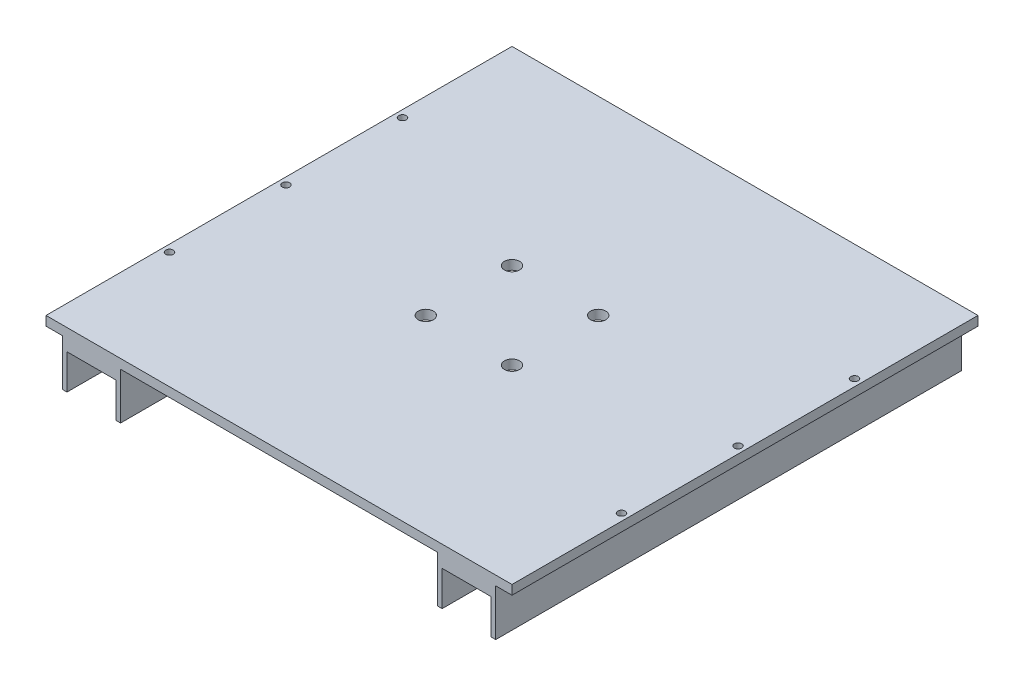
from build123d import *

# Parameters (mm, degrees)
SKETCH_1_W          = 200
SKETCH_1_H          = 200
EXTRUDE_1_DEPTH     = 4
SKETCH_2_W          = 2
SKETCH_2_H          = 200
EXTRUDE_2_DEPTH     = 20
SKETCH_4_R          = 3.25
SKETCH_4_R_2        = 1.6
CUT_EXTRUDE_1_DEPTH = 10
SKETCH_5_W          = 21
SKETCH_5_H          = 25
EXTRUDE_3_DEPTH     = 5


with BuildPart() as part:
    # 草图1 → 凸台-拉伸1 (new body)
    with BuildSketch(Plane(origin=(0, 0, 0), x_dir=(1, 0, 0), z_dir=(0, 1, 0))):
        Rectangle(SKETCH_1_W, SKETCH_1_H)
    extrude(amount=EXTRUDE_1_DEPTH)

    # 草图2 → 凸台-拉伸2 (add)
    with BuildSketch(Plane.XZ):
        with Locations((-69, 0)):
            Rectangle(SKETCH_2_W, SKETCH_2_H)
        with Locations((-92, 0)):
            Rectangle(SKETCH_2_W, SKETCH_2_H)
    extrude_2 = extrude(amount=EXTRUDE_2_DEPTH)

    # 镜向1: 凸台-拉伸2 across plane
    add(extrude_2.mirror(Plane(origin=(0, 0, 0), x_dir=(0, 0, 1), z_dir=(1, 0, 0))))

    # 草图4 → 切除-拉伸1 (cut)
    with BuildSketch(Plane(origin=(0, 4, 0), x_dir=(1, 0, 0), z_dir=(0, 1, 0))):
        with Locations(Location((18.5, 18.5, 0), (0, 0, 270))):
            Circle(SKETCH_4_R)
        with Locations(Location((18.5, -18.5, 0), (0, 0, 270))):
            Circle(SKETCH_4_R)
        with Locations(Location((-18.5, -18.5, 0), (0, 0, 270))):
            Circle(SKETCH_4_R)
        with Locations(Location((-18.5, 18.5, 0), (0, 0, 270))):
            Circle(SKETCH_4_R)
        with Locations(Location((97, -50, 0), (0, 0, 270))):
            Circle(SKETCH_4_R_2)
        with Locations(Location((97, 50, 0), (0, 0, 270))):
            Circle(SKETCH_4_R_2)
        with Locations(Location((-97, -50, 0), (0, 0, 270))):
            Circle(SKETCH_4_R_2)
        with Locations(Location((-97, 50, 0), (0, 0, 270))):
            Circle(SKETCH_4_R_2)
        with Locations(Location((-97, 0, 0), (0, 0, 270))):
            Circle(SKETCH_4_R_2)
        with Locations(Location((97, 0, 0), (0, 0, 270))):
            Circle(SKETCH_4_R_2)
    extrude(amount=-CUT_EXTRUDE_1_DEPTH, mode=Mode.SUBTRACT)

    # 草图5 → 凸台-拉伸3 (add)
    with BuildSketch(Plane.XZ):
        with Locations((80.5, 87.5)):
            Rectangle(SKETCH_5_W, SKETCH_5_H)
        with Locations((80.5, -87.5)):
            Rectangle(SKETCH_5_W, SKETCH_5_H)
    extrude_3 = extrude(amount=EXTRUDE_3_DEPTH)

    # 镜向2: 凸台-拉伸3 across plane
    add(extrude_3.mirror(Plane(origin=(0, 0, 0), x_dir=(0, 0, 1), z_dir=(1, 0, 0))))


solid = part.part
